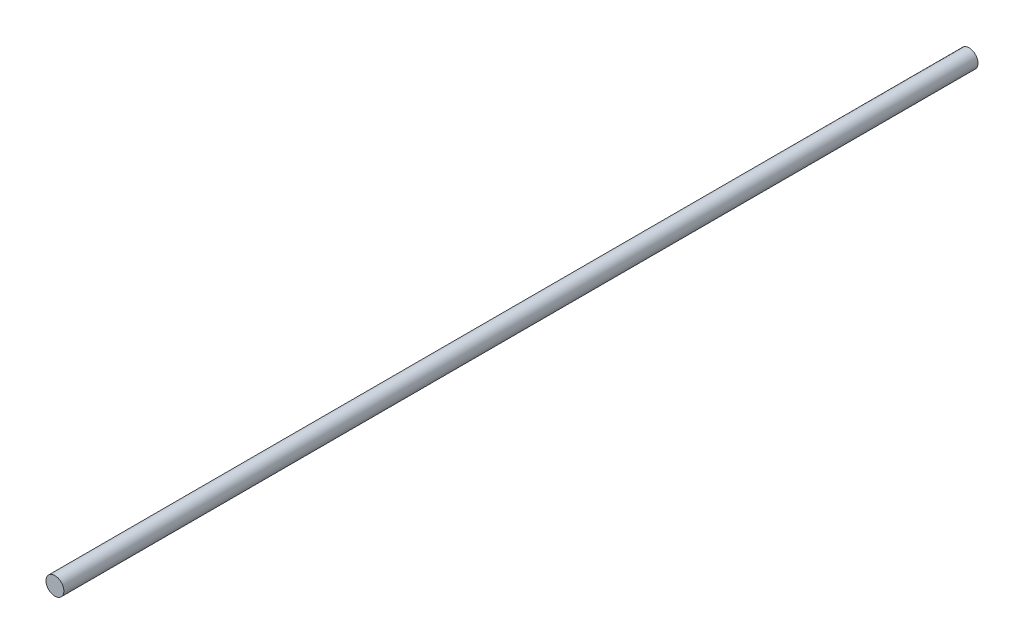
from build123d import *

# Parameters (mm, degrees)
SKETCH1_R           = 9.779
BOSS_EXTRUDE1_DEPTH = 1000


with BuildPart() as part:
    # Sketch1 → Boss-Extrude1 (new body)
    with BuildSketch(Plane.XY):
        Circle(SKETCH1_R)
    extrude(amount=BOSS_EXTRUDE1_DEPTH)


solid = part.part
